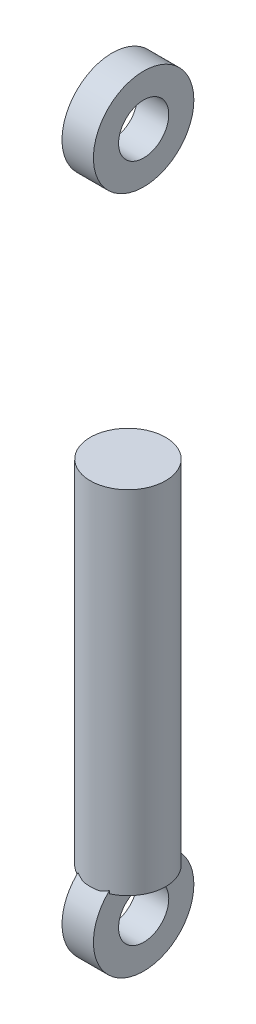
from build123d import *

# Parameters (mm, degrees)
SKETCH1_R             = 3.81
EXTRUDE1_DEPTH        = 35.56
SKETCH4_R             = 5.08
SKETCH4_R_2           = 2.54
EXTRUDE_THIN1_DEPTH   = 1.5875
EXTRUDE_THIN1_2_DEPTH = 1.5875


with BuildPart() as part:
    # Sketch1 → Extrude1 (new body)
    with BuildSketch(Plane(origin=(0, 0, 0), x_dir=(1, 0, 0), z_dir=(0, 1, 0))):
        with Locations(Location((0, 0, 0), (0, 0, 270))):
            Circle(SKETCH1_R)
    extrude(amount=EXTRUDE1_DEPTH)


with BuildPart() as body_2:
    # Sketch4 → Extrude-Thin1 (new, symmetric)
    with BuildSketch(Plane(origin=(0, 0, 0), x_dir=(0, 0, -1), z_dir=(1, 0, 0))):
        with Locations((0, 65.2665448)):
            Circle(SKETCH4_R)
        with Locations((0, 65.2665448)):
            Circle(SKETCH4_R_2, mode=Mode.SUBTRACT)
    extrude(amount=EXTRUDE_THIN1_DEPTH, both=True)


with BuildPart() as body_3:
    # Sketch4 → Extrude-Thin1 2 (new, symmetric)
    with BuildSketch(Plane(origin=(0, 0, 0), x_dir=(0, 0, -1), z_dir=(1, 0, 0))):
        with Locations((0, -3.4404552)):
            Circle(SKETCH4_R)
        with Locations((0, -3.4404552)):
            Circle(SKETCH4_R_2, mode=Mode.SUBTRACT)
    extrude(amount=EXTRUDE_THIN1_2_DEPTH, both=True)


solid = Compound([part.part, body_2.part, body_3.part])
